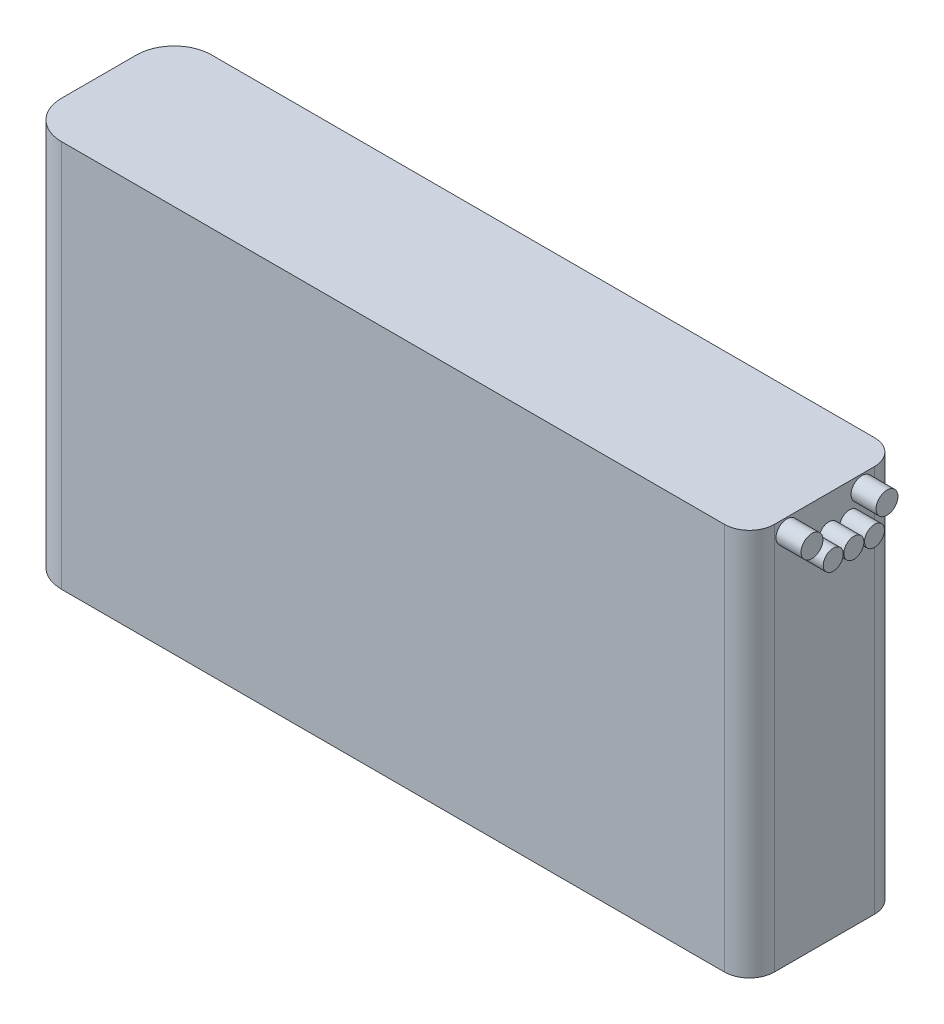
from build123d import *

# Parameters (mm, degrees)
SKIZZE1_W                       = 58
SKIZZE1_H                       = 31
AUFSATZ_LINEAR_AUSTRAGEN1_DEPTH = 12
VERRUNDUNG1_R                   = 2
VERRUNDUNG2_R                   = 3
SKIZZE3_R                       = 0.875
SKIZZE3_R_2                     = 0.8
AUFSATZ_LINEAR_AUSTRAGEN2_DEPTH = 2


with BuildPart() as part:
    # Skizze1 → Aufsatz-Linear austragen1 (new body)
    with BuildSketch(Plane.XY):
        with Locations((29, 15.5)):
            Rectangle(SKIZZE1_W, SKIZZE1_H)
    extrude(amount=AUFSATZ_LINEAR_AUSTRAGEN1_DEPTH)

    # Verrundung1
    verrundung1_edges = [part.edges().sort_by_distance(p)[0] for p in [
        (58, 15.5, 12),
        (58, 15.5, 0),
    ]]
    fillet(verrundung1_edges, radius=VERRUNDUNG1_R)

    # Verrundung2
    verrundung2_edges = [part.edges().sort_by_distance(p)[0] for p in [
        (0, 15.5, 12),
        (0, 15.5, 0),
    ]]
    fillet(verrundung2_edges, radius=VERRUNDUNG2_R)

    # Skizze3 → Aufsatz-Linear austragen2 (add)
    with BuildSketch(Plane(origin=(58, 0, 0), x_dir=(0, 0, -1), z_dir=(1, 0, 0))):
        with Locations(Location((-9, 30, 0), (0, 0, 180))):
            Circle(SKIZZE3_R)
        with Locations(Location((-3, 30, 0), (0, 0, 180))):
            Circle(SKIZZE3_R)
        with Locations(Location((-4, 28.2, 0), (0, 0, 180))):
            Circle(SKIZZE3_R_2)
        with Locations(Location((-5.65, 28.2, 0), (0, 0, 180))):
            Circle(SKIZZE3_R_2)
        with Locations(Location((-7.3, 28.2, 0), (0, 0, 180))):
            Circle(SKIZZE3_R_2)
    extrude(amount=AUFSATZ_LINEAR_AUSTRAGEN2_DEPTH)


solid = part.part
